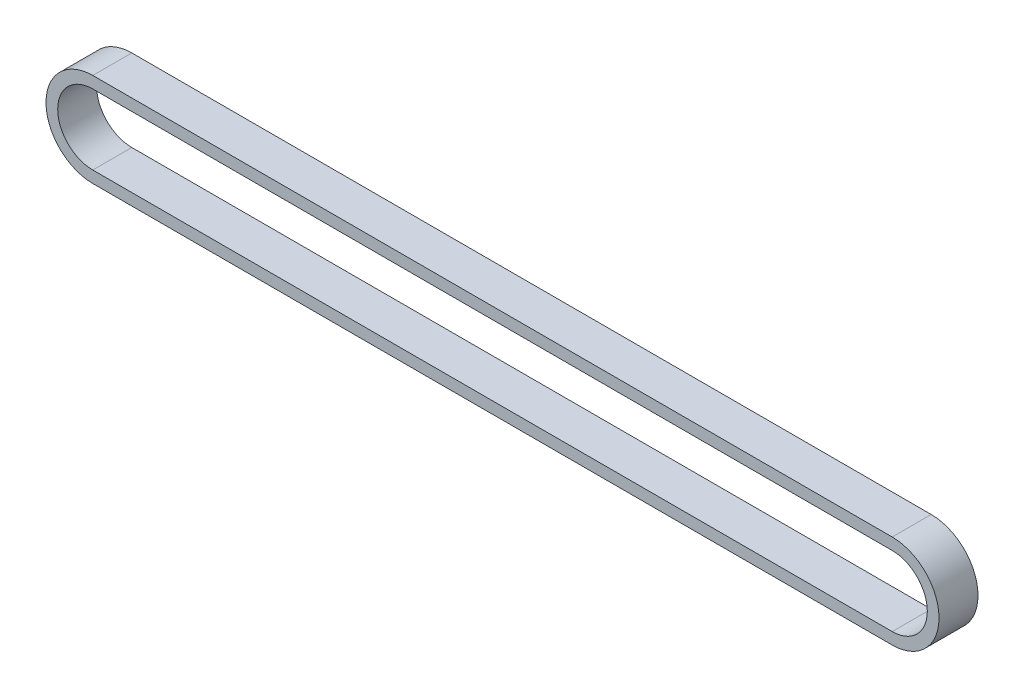
from build123d import *

# Parameters (mm, degrees)
EXTRUDE_1_DEPTH = 10


with BuildPart() as part:
    # 草图1 → 凸台-拉伸1 (new body)
    with BuildSketch(Plane.XY):
        with BuildLine():
            Line((0, 12), (205, 12))
            ThreePointArc((205, 12), (217, 0), (205, -12))
            Line((205, -12), (0, -12))
            ThreePointArc((0, -12), (-12, 0), (0, 12))
        make_face()
        with BuildLine():
            Line((0, 9), (205, 9))
            ThreePointArc((205, 9), (214, 0), (205, -9))
            Line((205, -9), (0, -9))
            ThreePointArc((0, -9), (-9, 0), (0, 9))
        make_face(mode=Mode.SUBTRACT)
    extrude(amount=EXTRUDE_1_DEPTH)


solid = part.part
